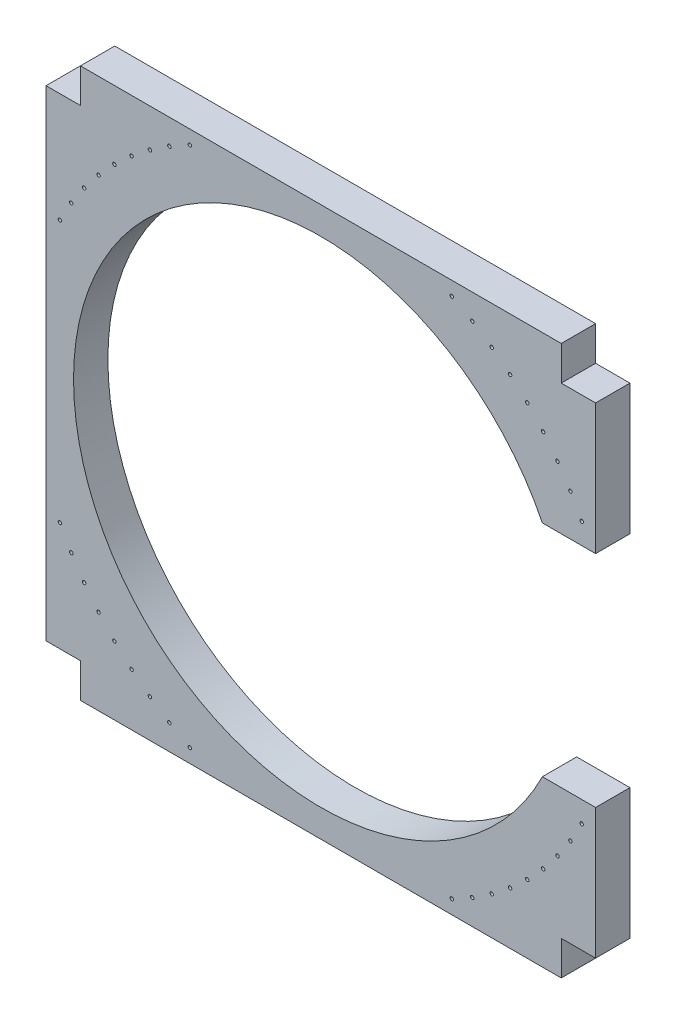
from build123d import *

# Parameters (mm, degrees)
ESQUISSE1_R        = 0.25
BOSS_EXTRU_1_DEPTH = 5
ESQUISSE2_W        = 5
ESQUISSE2_H        = 5
CR_NEAUX_DEPTH     = 5


with BuildPart() as part:
    # Esquisse1 → Boss.-Extru.1 (new body)
    with BuildSketch(Plane.XY):
        with BuildLine():
            Line((0, 80), (80, 80))
            Line((80, 80), (80, 56))
            Line((80, 56), (72.249030993, 56))
            ThreePointArc((72.249030993, 56), (4, 40), (72.249030993, 24))
            Line((72.249030993, 24), (80, 24))
            Line((80, 24), (80, 0))
            Line((80, 0), (0, 0))
            Line((0, 0), (0, 80))
        make_face()
        with Locations((2.018546053, 59.069849399)):
            Circle(ESQUISSE1_R, mode=Mode.SUBTRACT)
        with Locations((7.641889366, 67.553632723)):
            Circle(ESQUISSE1_R, mode=Mode.SUBTRACT)
        with Locations((9.9479618, 70.0520382)):
            Circle(ESQUISSE1_R, mode=Mode.SUBTRACT)
        with Locations((3.664453699, 62.04491041)):
            Circle(ESQUISSE1_R, mode=Mode.SUBTRACT)
        with Locations((5.542908841, 64.878883995)):
            Circle(ESQUISSE1_R, mode=Mode.SUBTRACT)
        with Locations(Location((20.930150601, 77.981453947, 0), (0, 0, 180))):
            Circle(ESQUISSE1_R, mode=Mode.SUBTRACT)
        with Locations(Location((17.95508959, 76.335546301, 0), (0, 0, 180))):
            Circle(ESQUISSE1_R, mode=Mode.SUBTRACT)
        with Locations(Location((15.121116005, 74.457091159, 0), (0, 0, 180))):
            Circle(ESQUISSE1_R, mode=Mode.SUBTRACT)
        with Locations(Location((12.446367277, 72.358110634, 0), (0, 0, 180))):
            Circle(ESQUISSE1_R, mode=Mode.SUBTRACT)
        with Locations((67.553632723, 72.358110634)):
            Circle(ESQUISSE1_R, mode=Mode.SUBTRACT)
        with Locations((64.878883995, 74.457091159)):
            Circle(ESQUISSE1_R, mode=Mode.SUBTRACT)
        with Locations((62.04491041, 76.335546301)):
            Circle(ESQUISSE1_R, mode=Mode.SUBTRACT)
        with Locations((59.069849399, 77.981453947)):
            Circle(ESQUISSE1_R, mode=Mode.SUBTRACT)
        with Locations(Location((74.457091159, 64.878883995, 0), (0, 0, 180))):
            Circle(ESQUISSE1_R, mode=Mode.SUBTRACT)
        with Locations(Location((76.335546301, 62.04491041, 0), (0, 0, 180))):
            Circle(ESQUISSE1_R, mode=Mode.SUBTRACT)
        with Locations(Location((70.0520382, 70.0520382, 0), (0, 0, 180))):
            Circle(ESQUISSE1_R, mode=Mode.SUBTRACT)
        with Locations(Location((72.358110634, 67.553632723, 0), (0, 0, 180))):
            Circle(ESQUISSE1_R, mode=Mode.SUBTRACT)
        with Locations(Location((77.981453947, 59.069849399, 0), (0, 0, 180))):
            Circle(ESQUISSE1_R, mode=Mode.SUBTRACT)
        with Locations((77.981453947, 20.930150601)):
            Circle(ESQUISSE1_R, mode=Mode.SUBTRACT)
        with Locations((72.358110634, 12.446367277)):
            Circle(ESQUISSE1_R, mode=Mode.SUBTRACT)
        with Locations((70.0520382, 9.9479618)):
            Circle(ESQUISSE1_R, mode=Mode.SUBTRACT)
        with Locations((76.335546301, 17.95508959)):
            Circle(ESQUISSE1_R, mode=Mode.SUBTRACT)
        with Locations((74.457091159, 15.121116005)):
            Circle(ESQUISSE1_R, mode=Mode.SUBTRACT)
        with Locations(Location((59.069849399, 2.018546053, 0), (0, 0, 180))):
            Circle(ESQUISSE1_R, mode=Mode.SUBTRACT)
        with Locations(Location((62.04491041, 3.664453699, 0), (0, 0, 180))):
            Circle(ESQUISSE1_R, mode=Mode.SUBTRACT)
        with Locations(Location((64.878883995, 5.542908841, 0), (0, 0, 180))):
            Circle(ESQUISSE1_R, mode=Mode.SUBTRACT)
        with Locations(Location((67.553632723, 7.641889366, 0), (0, 0, 180))):
            Circle(ESQUISSE1_R, mode=Mode.SUBTRACT)
        with Locations((12.446367277, 7.641889366)):
            Circle(ESQUISSE1_R, mode=Mode.SUBTRACT)
        with Locations((15.121116005, 5.542908841)):
            Circle(ESQUISSE1_R, mode=Mode.SUBTRACT)
        with Locations((17.95508959, 3.664453699)):
            Circle(ESQUISSE1_R, mode=Mode.SUBTRACT)
        with Locations((20.930150601, 2.018546053)):
            Circle(ESQUISSE1_R, mode=Mode.SUBTRACT)
        with Locations(Location((5.542908841, 15.121116005, 0), (0, 0, 180))):
            Circle(ESQUISSE1_R, mode=Mode.SUBTRACT)
        with Locations(Location((3.664453699, 17.95508959, 0), (0, 0, 180))):
            Circle(ESQUISSE1_R, mode=Mode.SUBTRACT)
        with Locations(Location((9.9479618, 9.9479618, 0), (0, 0, 180))):
            Circle(ESQUISSE1_R, mode=Mode.SUBTRACT)
        with Locations(Location((7.641889366, 12.446367277, 0), (0, 0, 180))):
            Circle(ESQUISSE1_R, mode=Mode.SUBTRACT)
        with Locations(Location((2.018546053, 20.930150601, 0), (0, 0, 180))):
            Circle(ESQUISSE1_R, mode=Mode.SUBTRACT)
    extrude(amount=BOSS_EXTRU_1_DEPTH)

    # Esquisse2 → Créneaux - (cut)
    with BuildSketch(Plane(origin=(0, 0, 0), x_dir=(-1, 0, 0), z_dir=(0, 0, -1))):
        with Locations((-2.5, 2.5)):
            Rectangle(ESQUISSE2_W, ESQUISSE2_H)
        with Locations((-77.5, 2.5)):
            Rectangle(ESQUISSE2_W, ESQUISSE2_H)
        with Locations((-77.5, 77.5)):
            Rectangle(ESQUISSE2_W, ESQUISSE2_H)
        with Locations((-2.5, 77.5)):
            Rectangle(ESQUISSE2_W, ESQUISSE2_H)
    extrude(amount=-CR_NEAUX_DEPTH, mode=Mode.SUBTRACT)


solid = part.part
